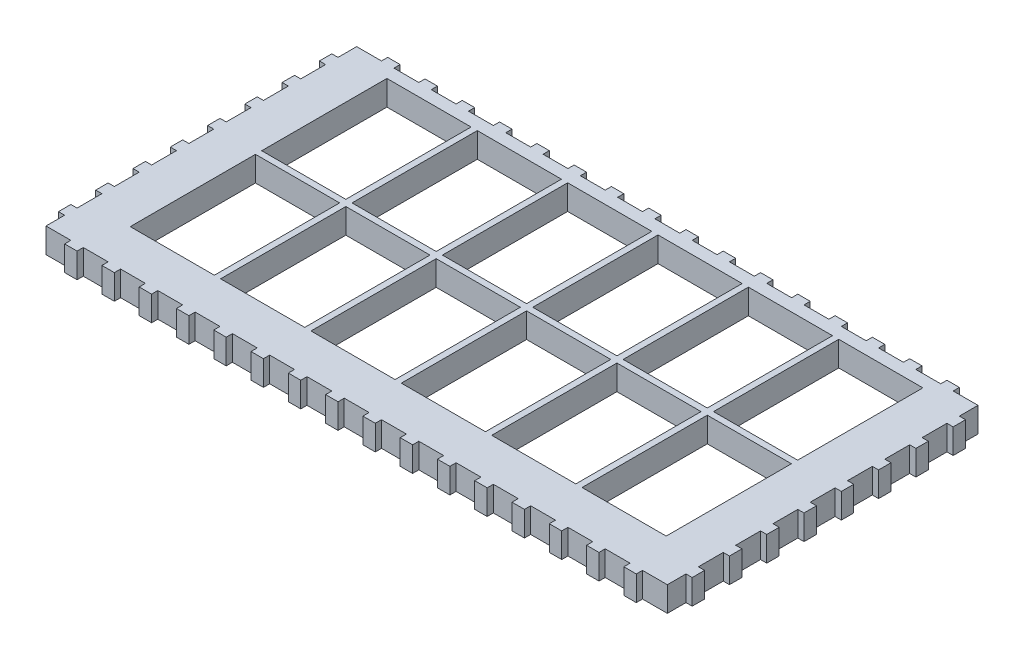
from build123d import *

# Parameters (mm, degrees)
SKETCH7_W           = 635
SKETCH7_H           = 317.5
SKETCH7_W_2         = 86.0000058
SKETCH7_H_2         = 127.999998
BOSS_EXTRUDE4_DEPTH = 25.4
SKETCH8_W           = 12.7
SKETCH8_H           = 6.35
SKETCH8_W_2         = 6.35
SKETCH8_H_2         = 12.7
BOSS_EXTRUDE5_DEPTH = 25.4


with BuildPart() as part:
    # Sketch7 → Boss-Extrude4 (new body)
    with BuildSketch(Plane(origin=(0, 0, 0), x_dir=(1, 0, 0), z_dir=(0, 1, 0))):
        Rectangle(SKETCH7_W, SKETCH7_H)
        with Locations((-138.5250087, 82.050001)):
            Rectangle(SKETCH7_W_2, SKETCH7_H_2, mode=Mode.SUBTRACT)
        with Locations((-230.8750145, 82.050001)):
            Rectangle(SKETCH7_W_2, SKETCH7_H_2, mode=Mode.SUBTRACT)
        with Locations((-46.1750029, 82.050001)):
            Rectangle(SKETCH7_W_2, SKETCH7_H_2, mode=Mode.SUBTRACT)
        with Locations((46.1750029, 82.050001)):
            Rectangle(SKETCH7_W_2, SKETCH7_H_2, mode=Mode.SUBTRACT)
        with Locations((138.5250087, 82.050001)):
            Rectangle(SKETCH7_W_2, SKETCH7_H_2, mode=Mode.SUBTRACT)
        with Locations((230.8750145, 82.050001)):
            Rectangle(SKETCH7_W_2, SKETCH7_H_2, mode=Mode.SUBTRACT)
        with Locations((-138.5250087, -52.299997)):
            Rectangle(SKETCH7_W_2, SKETCH7_H_2, mode=Mode.SUBTRACT)
        with Locations((-46.1750029, -52.299997)):
            Rectangle(SKETCH7_W_2, SKETCH7_H_2, mode=Mode.SUBTRACT)
        with Locations((46.1750029, -52.299997)):
            Rectangle(SKETCH7_W_2, SKETCH7_H_2, mode=Mode.SUBTRACT)
        with Locations((138.5250087, -52.299997)):
            Rectangle(SKETCH7_W_2, SKETCH7_H_2, mode=Mode.SUBTRACT)
        with Locations((230.8750145, -52.299997)):
            Rectangle(SKETCH7_W_2, SKETCH7_H_2, mode=Mode.SUBTRACT)
        with Locations((-230.8750145, -52.299997)):
            Rectangle(SKETCH7_W_2, SKETCH7_H_2, mode=Mode.SUBTRACT)
    extrude(amount=BOSS_EXTRUDE4_DEPTH)

    # Sketch8 → Boss-Extrude5 (add)
    with BuildSketch(Plane(origin=(0, 0, 0), x_dir=(1, 0, 0), z_dir=(0, 1, 0))):
        with Locations((-285.75, 161.925)):
            Rectangle(SKETCH8_W, SKETCH8_H)
        with Locations((19.05, 161.925)):
            Rectangle(SKETCH8_W, SKETCH8_H)
        with Locations((-320.675, 133.35)):
            Rectangle(SKETCH8_W_2, SKETCH8_H_2)
        with Locations((-320.675, 95.25)):
            Rectangle(SKETCH8_W_2, SKETCH8_H_2)
        with Locations((-320.675, 57.15)):
            Rectangle(SKETCH8_W_2, SKETCH8_H_2)
        with Locations((-320.675, 19.05)):
            Rectangle(SKETCH8_W_2, SKETCH8_H_2)
        with Locations((-320.675, -19.05)):
            Rectangle(SKETCH8_W_2, SKETCH8_H_2)
        with Locations((-320.675, -57.15)):
            Rectangle(SKETCH8_W_2, SKETCH8_H_2)
        with Locations((-320.675, -95.25)):
            Rectangle(SKETCH8_W_2, SKETCH8_H_2)
        with Locations((-320.675, -133.35)):
            Rectangle(SKETCH8_W_2, SKETCH8_H_2)
        with Locations((-247.65, 161.925)):
            Rectangle(SKETCH8_W, SKETCH8_H)
        with Locations((-209.55, 161.925)):
            Rectangle(SKETCH8_W, SKETCH8_H)
        with Locations((-171.45, 161.925)):
            Rectangle(SKETCH8_W, SKETCH8_H)
        with Locations((-133.35, 161.925)):
            Rectangle(SKETCH8_W, SKETCH8_H)
        with Locations((-95.25, 161.925)):
            Rectangle(SKETCH8_W, SKETCH8_H)
        with Locations((-57.15, 161.925)):
            Rectangle(SKETCH8_W, SKETCH8_H)
        with Locations((-19.05, 161.925)):
            Rectangle(SKETCH8_W, SKETCH8_H)
        with Locations((57.15, 161.925)):
            Rectangle(SKETCH8_W, SKETCH8_H)
        with Locations((95.25, 161.925)):
            Rectangle(SKETCH8_W, SKETCH8_H)
        with Locations((133.35, 161.925)):
            Rectangle(SKETCH8_W, SKETCH8_H)
        with Locations((171.45, 161.925)):
            Rectangle(SKETCH8_W, SKETCH8_H)
        with Locations((209.55, 161.925)):
            Rectangle(SKETCH8_W, SKETCH8_H)
        with Locations((247.65, 161.925)):
            Rectangle(SKETCH8_W, SKETCH8_H)
        with Locations((285.75, 161.925)):
            Rectangle(SKETCH8_W, SKETCH8_H)
        with Locations((320.675, -133.35)):
            Rectangle(SKETCH8_W_2, SKETCH8_H_2)
        with Locations((320.675, -95.25)):
            Rectangle(SKETCH8_W_2, SKETCH8_H_2)
        with Locations((320.675, -57.15)):
            Rectangle(SKETCH8_W_2, SKETCH8_H_2)
        with Locations((320.675, -19.05)):
            Rectangle(SKETCH8_W_2, SKETCH8_H_2)
        with Locations((320.675, 19.05)):
            Rectangle(SKETCH8_W_2, SKETCH8_H_2)
        with Locations((320.675, 57.15)):
            Rectangle(SKETCH8_W_2, SKETCH8_H_2)
        with Locations((320.675, 95.25)):
            Rectangle(SKETCH8_W_2, SKETCH8_H_2)
        with Locations((320.675, 133.35)):
            Rectangle(SKETCH8_W_2, SKETCH8_H_2)
        with Locations((285.75, -161.925)):
            Rectangle(SKETCH8_W, SKETCH8_H)
        with Locations((247.65, -161.925)):
            Rectangle(SKETCH8_W, SKETCH8_H)
        with Locations((209.55, -161.925)):
            Rectangle(SKETCH8_W, SKETCH8_H)
        with Locations((171.45, -161.925)):
            Rectangle(SKETCH8_W, SKETCH8_H)
        with Locations((133.35, -161.925)):
            Rectangle(SKETCH8_W, SKETCH8_H)
        with Locations((95.25, -161.925)):
            Rectangle(SKETCH8_W, SKETCH8_H)
        with Locations((57.15, -161.925)):
            Rectangle(SKETCH8_W, SKETCH8_H)
        with Locations((19.05, -161.925)):
            Rectangle(SKETCH8_W, SKETCH8_H)
        with Locations((-19.05, -161.925)):
            Rectangle(SKETCH8_W, SKETCH8_H)
        with Locations((-57.15, -161.925)):
            Rectangle(SKETCH8_W, SKETCH8_H)
        with Locations((-95.25, -161.925)):
            Rectangle(SKETCH8_W, SKETCH8_H)
        with Locations((-133.35, -161.925)):
            Rectangle(SKETCH8_W, SKETCH8_H)
        with Locations((-171.45, -161.925)):
            Rectangle(SKETCH8_W, SKETCH8_H)
        with Locations((-209.55, -161.925)):
            Rectangle(SKETCH8_W, SKETCH8_H)
        with Locations((-247.65, -161.925)):
            Rectangle(SKETCH8_W, SKETCH8_H)
        with Locations((-285.75, -161.925)):
            Rectangle(SKETCH8_W, SKETCH8_H)
    extrude(amount=BOSS_EXTRUDE5_DEPTH)


solid = part.part
